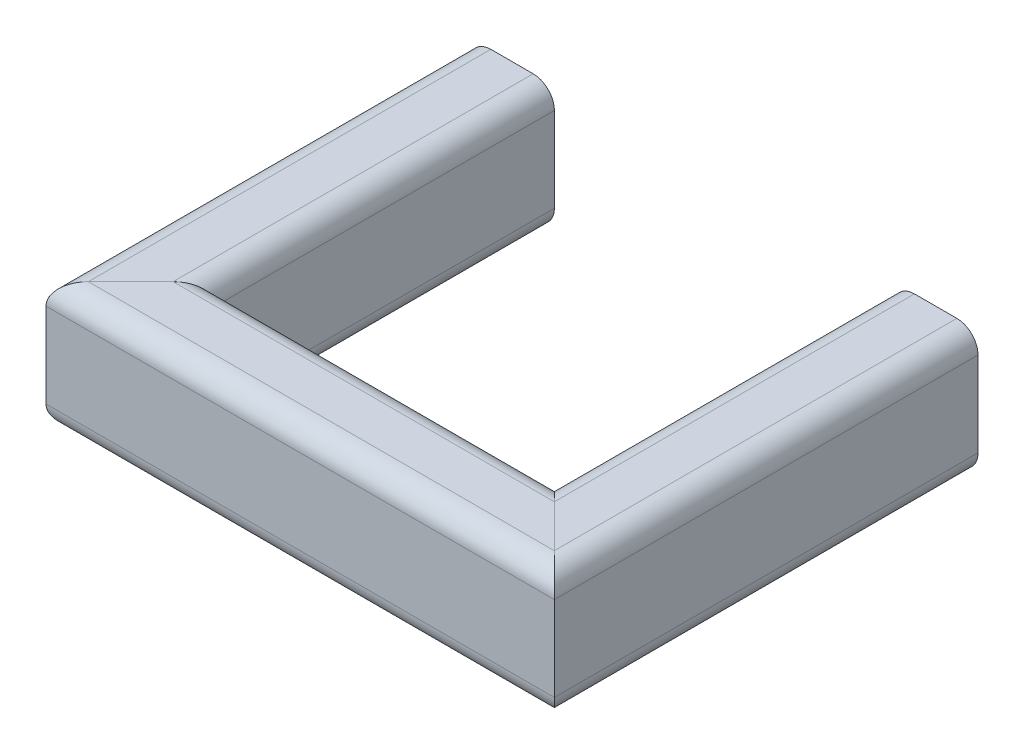
from build123d import *

# Parameters (mm, degrees)
RECTANGULAR_TUBE_CONFIGURED_3_X_2_X_0_DEPTH    = 275.39046704
RECTANGULAR_TUBE_CONFIGURED_3_X_2_3_DEPTH      = 347.58093408
RECTANGULAR_TUBE_CONFIGURED_3_X_2_5_DEPTH      = 203.2
RECTANGULAR_TUBE_CONFIGURED_3_X_2_5_DEPTH_BACK = 72.19046704


with BuildPart() as part:
    # Sketch11 on segment 1 (carried to segment 1) → Rectangular tube - configured 3 X 2 X 0.25(1) (new body)
    with BuildSketch(Plane(origin=(-126.999978029, 0, -203.2), x_dir=(1, 0, 0), z_dir=(0, 0, 1))):
        with BuildLine():
            Line((-12.699978029, -38.1), (12.699978029, -38.1))
            ThreePointArc((12.699978029, -38.1), (21.68023415, -34.380256121), (25.399978029, -25.4))
            Line((25.399978029, -25.4), (25.399978029, 25.4))
            ThreePointArc((25.399978029, 25.4), (21.68023415, 34.380256121), (12.699978029, 38.1))
            Line((12.699978029, 38.1), (-12.699978029, 38.1))
            ThreePointArc((-12.699978029, 38.1), (-21.68023415, 34.380256121), (-25.399978029, 25.4))
            Line((-25.399978029, 25.4), (-25.399978029, -25.4))
            ThreePointArc((-25.399978029, -25.4), (-21.68023415, -34.380256121), (-12.699978029, -38.1))
        make_face()
        with BuildLine():
            Line((-12.699978029, -31.75), (12.699978029, -31.75))
            ThreePointArc((12.699978029, -31.75), (17.19010609, -29.890128061), (19.049978029, -25.4))
            Line((19.049978029, -25.4), (19.049978029, 25.4))
            ThreePointArc((19.049978029, 25.4), (17.19010609, 29.890128061), (12.699978029, 31.75))
            Line((12.699978029, 31.75), (-12.699978029, 31.75))
            ThreePointArc((-12.699978029, 31.75), (-17.19010609, 29.890128061), (-19.049978029, 25.4))
            Line((-19.049978029, 25.4), (-19.049978029, -25.4))
            ThreePointArc((-19.049978029, -25.4), (-17.19010609, -29.890128061), (-12.699978029, -31.75))
        make_face(mode=Mode.SUBTRACT)
    extrude(amount=RECTANGULAR_TUBE_CONFIGURED_3_X_2_X_0_DEPTH)

    # Rectangular tube - configured 3 X 2  2
    split(bisect_by=Plane(origin=(-101.6, 0, 0), x_dir=(0, -1, 0), z_dir=(-0.707106781, 0, -0.707106781)), keep=Keep.TOP)


with BuildPart() as body_2:
    # Sketch11 on segment 2 (carried to segment 2) → Rectangular tube - configured 3 X 2  3 (new body)
    with BuildSketch(Plane(origin=(-173.79046704, 0, 25.399978029), x_dir=(0, 0, -1), z_dir=(1, 0, 0))):
        with BuildLine():
            Line((-12.699978029, -38.1), (12.699978029, -38.1))
            ThreePointArc((12.699978029, -38.1), (21.68023415, -34.380256121), (25.399978029, -25.4))
            Line((25.399978029, -25.4), (25.399978029, 25.4))
            ThreePointArc((25.399978029, 25.4), (21.68023415, 34.380256121), (12.699978029, 38.1))
            Line((12.699978029, 38.1), (-12.699978029, 38.1))
            ThreePointArc((-12.699978029, 38.1), (-21.68023415, 34.380256121), (-25.399978029, 25.4))
            Line((-25.399978029, 25.4), (-25.399978029, -25.4))
            ThreePointArc((-25.399978029, -25.4), (-21.68023415, -34.380256121), (-12.699978029, -38.1))
        make_face()
        with BuildLine():
            Line((-12.699978029, -31.75), (12.699978029, -31.75))
            ThreePointArc((12.699978029, -31.75), (17.19010609, -29.890128061), (19.049978029, -25.4))
            Line((19.049978029, -25.4), (19.049978029, 25.4))
            ThreePointArc((19.049978029, 25.4), (17.19010609, 29.890128061), (12.699978029, 31.75))
            Line((12.699978029, 31.75), (-12.699978029, 31.75))
            ThreePointArc((-12.699978029, 31.75), (-17.19010609, 29.890128061), (-19.049978029, 25.4))
            Line((-19.049978029, 25.4), (-19.049978029, -25.4))
            ThreePointArc((-19.049978029, -25.4), (-17.19010609, -29.890128061), (-12.699978029, -31.75))
        make_face(mode=Mode.SUBTRACT)
    extrude(amount=RECTANGULAR_TUBE_CONFIGURED_3_X_2_3_DEPTH)

    # Rectangular tube - configured 3 X 2 3 mi
    split(bisect_by=Plane(origin=(-101.6, 0, 0), x_dir=(0, 1, 0), z_dir=(0.707106781, 0, 0.707106781)), keep=Keep.TOP)

    # Rectangular tube - configured 3 X 2  4
    split(bisect_by=Plane(origin=(101.6, 0, 0), x_dir=(0, -1, 0), z_dir=(-0.707106781, 0, 0.707106781)), keep=Keep.TOP)


with BuildPart() as body_3:
    # Sketch11 → Rectangular tube - configured 3 X 2  5 (new, two sides: drawn at the far end of the back side and taken through both)
    with BuildSketch(Plane(origin=(126.999978029, 0, 0), x_dir=(-1, 0, 0), z_dir=(0, 0, -1)).offset(-RECTANGULAR_TUBE_CONFIGURED_3_X_2_5_DEPTH_BACK)):
        with BuildLine():
            Line((-12.699978029, -38.1), (12.699978029, -38.1))
            ThreePointArc((12.699978029, -38.1), (21.68023415, -34.380256121), (25.399978029, -25.4))
            Line((25.399978029, -25.4), (25.399978029, 25.4))
            ThreePointArc((25.399978029, 25.4), (21.68023415, 34.380256121), (12.699978029, 38.1))
            Line((12.699978029, 38.1), (-12.699978029, 38.1))
            ThreePointArc((-12.699978029, 38.1), (-21.68023415, 34.380256121), (-25.399978029, 25.4))
            Line((-25.399978029, 25.4), (-25.399978029, -25.4))
            ThreePointArc((-25.399978029, -25.4), (-21.68023415, -34.380256121), (-12.699978029, -38.1))
        make_face()
        with BuildLine():
            Line((-12.699978029, -31.75), (12.699978029, -31.75))
            ThreePointArc((12.699978029, -31.75), (17.19010609, -29.890128061), (19.049978029, -25.4))
            Line((19.049978029, -25.4), (19.049978029, 25.4))
            ThreePointArc((19.049978029, 25.4), (17.19010609, 29.890128061), (12.699978029, 31.75))
            Line((12.699978029, 31.75), (-12.699978029, 31.75))
            ThreePointArc((-12.699978029, 31.75), (-17.19010609, 29.890128061), (-19.049978029, 25.4))
            Line((-19.049978029, 25.4), (-19.049978029, -25.4))
            ThreePointArc((-19.049978029, -25.4), (-17.19010609, -29.890128061), (-12.699978029, -31.75))
        make_face(mode=Mode.SUBTRACT)
    extrude(amount=RECTANGULAR_TUBE_CONFIGURED_3_X_2_5_DEPTH + RECTANGULAR_TUBE_CONFIGURED_3_X_2_5_DEPTH_BACK)

    # Rectangular tube - configured 3 X 2 5 mi
    split(bisect_by=Plane(origin=(101.6, 0, 0), x_dir=(0, 1, 0), z_dir=(0.707106781, 0, -0.707106781)), keep=Keep.TOP)


solid = Compound([part.part, body_2.part, body_3.part])
